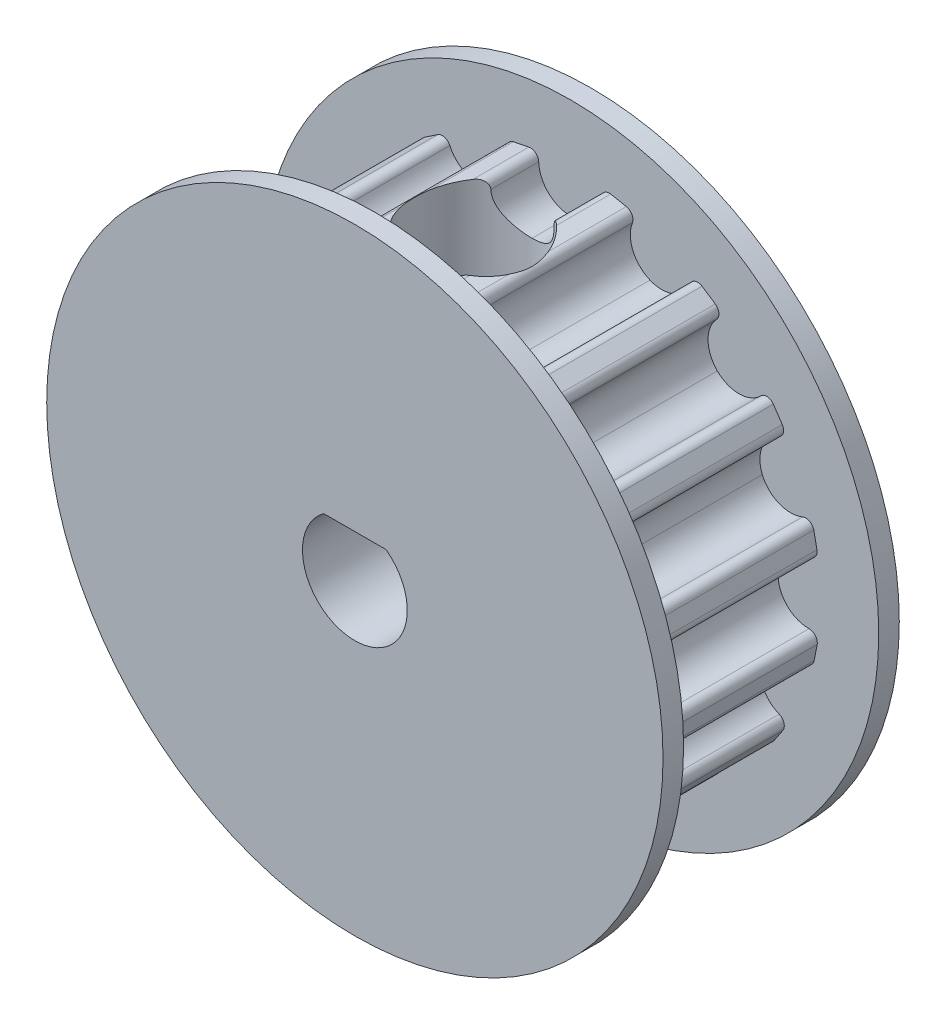
from build123d import *

# Parameters (mm, degrees)
PULLEY_PROFILE_EXTRUSION_DEPTH      = 4.75
PULLEY_PROFILE_EXTRUSION_DEPTH_BACK = 4.75
PULLEY_FLANGE_SKETCH_R              = 15
PULLEY_FLANGE_EXTRUSION_DEPTH       = 1
D_SHAFT_CUT_DEPTH                   = 25.129857024
F_3MM_BOLT_HEAD_HOLE_DEPTH          = 3.1
F_3MM_BOLT_HEAD_HOLE_DEPTH_BACK     = 30.80256293
F_3MM_BOLT_HEAD_SKETCH_R            = 2.875
HEAT_SET_INSERT_SKETCH_R            = 2.3
F_3MM_HEAT_SET_INSERT_HOLE_DEPTH    = 4
F_3MM_BOLT_SHAFT_HOLE_REACH         = 26.128
BOLT_SHAFT_SKETCH_R                 = 1.75


with BuildPart() as part:
    # Pulley Profile → Pulley Profile Extrusion (new, two sides: drawn at the far end of the back side and taken through both)
    with BuildSketch(Plane(origin=(0, 0, 0), x_dir=(0, 1, 0), z_dir=(0, 0, 1)).offset(-PULLEY_PROFILE_EXTRUSION_DEPTH_BACK)):
        with BuildLine():
            Line((1.954191923, 12.004374076), (2.712877822, 11.855975579))
            ThreePointArc((2.712877822, 11.855975579), (2.985721469, 11.657585969), (3.009663583, 11.321090993))
            ThreePointArc((3.009663583, 11.321090993), (3.034360349, 10.153412461), (3.866019365, 9.333396383))
            ThreePointArc((3.866019365, 9.333396383), (5.012665119, 9.336001505), (5.817923106, 10.152312012))
            ThreePointArc((5.817923106, 10.152312012), (6.064332614, 10.382728612), (6.399312995, 10.342758636))
            Line((6.399312995, 10.342758636), (7.043457723, 9.915319779))
            ThreePointArc((7.043457723, 9.915319779), (7.219611967, 9.627618935), (7.112960544, 9.307575864))
            ThreePointArc((7.112960544, 9.307575864), (6.688926151, 8.219330524), (7.143472327, 7.143472327))
            ThreePointArc((7.143472327, 7.143472327), (8.203831807, 6.707076813), (9.260181687, 7.153090492))
            ThreePointArc((9.260181687, 7.153090492), (9.576011003, 7.271670837), (9.870196673, 7.106551952))
            Line((9.870196673, 7.106551952), (10.301735035, 6.465146425))
            ThreePointArc((10.301735035, 6.465146425), (10.354381988, 6.131934193), (10.133373741, 5.877066683))
            ThreePointArc((10.133373741, 5.877066683), (9.325163582, 5.033930024), (9.333396383, 3.866019365))
            ThreePointArc((9.333396383, 3.866019365), (10.146039471, 3.057060476), (11.29266155, 3.064875788))
            ThreePointArc((11.29266155, 3.064875788), (11.629828524, 3.053567094), (11.838432382, 2.788437154))
            Line((11.838432382, 2.788437154), (11.991666572, 2.030713134))
            ThreePointArc((11.991666572, 2.030713134), (11.912791215, 1.702718056), (11.611072645, 1.551827375))
            ThreePointArc((11.611072645, 1.551827375), (10.541729391, 1.08215931), (10.102395447, 0))
            ThreePointArc((10.102395447, 0), (10.543604599, -1.058365606), (11.605936059, -1.489938472))
            ThreePointArc((11.605936059, -1.489938472), (11.913110076, -1.629414558), (12.004374076, -1.954191923))
            Line((12.004374076, -1.954191923), (11.855975579, -2.712877822))
            ThreePointArc((11.855975579, -2.712877822), (11.657585969, -2.985721469), (11.321090993, -3.009663583))
            ThreePointArc((11.321090993, -3.009663583), (10.153412461, -3.034360349), (9.333396383, -3.866019365))
            ThreePointArc((9.333396383, -3.866019365), (9.336001505, -5.012665119), (10.152312012, -5.817923106))
            ThreePointArc((10.152312012, -5.817923106), (10.382728612, -6.064332614), (10.342758636, -6.399312995))
            Line((10.342758636, -6.399312995), (9.915319779, -7.043457723))
            ThreePointArc((9.915319779, -7.043457723), (9.627618935, -7.219611967), (9.307575864, -7.112960544))
            ThreePointArc((9.307575864, -7.112960544), (8.219330524, -6.688926151), (7.143472327, -7.143472327))
            ThreePointArc((7.143472327, -7.143472327), (6.707076813, -8.203831807), (7.153090492, -9.260181687))
            ThreePointArc((7.153090492, -9.260181687), (7.271670837, -9.576011003), (7.106551952, -9.870196673))
            Line((7.106551952, -9.870196673), (6.465146425, -10.301735035))
            ThreePointArc((6.465146425, -10.301735035), (6.131934193, -10.354381988), (5.877066683, -10.133373741))
            ThreePointArc((5.877066683, -10.133373741), (5.033930024, -9.325163582), (3.866019365, -9.333396383))
            ThreePointArc((3.866019365, -9.333396383), (3.057060476, -10.146039471), (3.064875788, -11.29266155))
            ThreePointArc((3.064875788, -11.29266155), (3.053567094, -11.629828524), (2.788437154, -11.838432382))
            Line((2.788437154, -11.838432382), (2.030713134, -11.991666572))
            ThreePointArc((2.030713134, -11.991666572), (1.702718056, -11.912791215), (1.551827375, -11.611072645))
            ThreePointArc((1.551827375, -11.611072645), (1.08215931, -10.541729391), (0, -10.102395447))
            ThreePointArc((0, -10.102395447), (-1.058365606, -10.543604599), (-1.489938472, -11.605936059))
            ThreePointArc((-1.489938472, -11.605936059), (-1.629414558, -11.913110076), (-1.954191923, -12.004374076))
            Line((-1.954191923, -12.004374076), (-2.712877822, -11.855975579))
            ThreePointArc((-2.712877822, -11.855975579), (-2.985721469, -11.657585969), (-3.009663583, -11.321090993))
            ThreePointArc((-3.009663583, -11.321090993), (-3.034360349, -10.153412461), (-3.866019365, -9.333396383))
            ThreePointArc((-3.866019365, -9.333396383), (-5.012665119, -9.336001505), (-5.817923106, -10.152312012))
            ThreePointArc((-5.817923106, -10.152312012), (-6.064332614, -10.382728612), (-6.399312995, -10.342758636))
            Line((-6.399312995, -10.342758636), (-7.043457723, -9.915319779))
            ThreePointArc((-7.043457723, -9.915319779), (-7.219611967, -9.627618935), (-7.112960544, -9.307575864))
            ThreePointArc((-7.112960544, -9.307575864), (-6.688926151, -8.219330524), (-7.143472327, -7.143472327))
            ThreePointArc((-7.143472327, -7.143472327), (-8.203831807, -6.707076813), (-9.260181687, -7.153090492))
            ThreePointArc((-9.260181687, -7.153090492), (-9.576011003, -7.271670837), (-9.870196673, -7.106551952))
            Line((-9.870196673, -7.106551952), (-10.301735035, -6.465146425))
            ThreePointArc((-10.301735035, -6.465146425), (-10.354381988, -6.131934193), (-10.133373741, -5.877066683))
            ThreePointArc((-10.133373741, -5.877066683), (-9.325163582, -5.033930024), (-9.333396383, -3.866019365))
            ThreePointArc((-9.333396383, -3.866019365), (-10.146039471, -3.057060476), (-11.29266155, -3.064875788))
            ThreePointArc((-11.29266155, -3.064875788), (-11.629828524, -3.053567094), (-11.838432382, -2.788437154))
            Line((-11.838432382, -2.788437154), (-11.991666572, -2.030713134))
            ThreePointArc((-11.991666572, -2.030713134), (-11.912791215, -1.702718056), (-11.611072645, -1.551827375))
            ThreePointArc((-11.611072645, -1.551827375), (-10.541729391, -1.08215931), (-10.102395447, 0))
            ThreePointArc((-10.102395447, 0), (-10.543604599, 1.058365606), (-11.605936059, 1.489938472))
            ThreePointArc((-11.605936059, 1.489938472), (-11.913110076, 1.629414558), (-12.004374076, 1.954191923))
            Line((-12.004374076, 1.954191923), (-11.855975579, 2.712877822))
            ThreePointArc((-11.855975579, 2.712877822), (-11.657585969, 2.985721469), (-11.321090993, 3.009663583))
            ThreePointArc((-11.321090993, 3.009663583), (-10.153412461, 3.034360349), (-9.333396383, 3.866019365))
            ThreePointArc((-9.333396383, 3.866019365), (-9.336001505, 5.012665119), (-10.152312012, 5.817923106))
            ThreePointArc((-10.152312012, 5.817923106), (-10.382728612, 6.064332614), (-10.342758636, 6.399312995))
            Line((-10.342758636, 6.399312995), (-9.915319779, 7.043457723))
            ThreePointArc((-9.915319779, 7.043457723), (-9.627618935, 7.219611967), (-9.307575864, 7.112960544))
            ThreePointArc((-9.307575864, 7.112960544), (-8.219330524, 6.688926151), (-7.143472327, 7.143472327))
            ThreePointArc((-7.143472327, 7.143472327), (-6.707076813, 8.203831807), (-7.153090492, 9.260181687))
            ThreePointArc((-7.153090492, 9.260181687), (-7.271670837, 9.576011003), (-7.106551952, 9.870196673))
            Line((-7.106551952, 9.870196673), (-6.465146425, 10.301735035))
            ThreePointArc((-6.465146425, 10.301735035), (-6.131934193, 10.354381988), (-5.877066683, 10.133373741))
            ThreePointArc((-5.877066683, 10.133373741), (-5.033930024, 9.325163582), (-3.866019365, 9.333396383))
            ThreePointArc((-3.866019365, 9.333396383), (-3.057060476, 10.146039471), (-3.064875788, 11.29266155))
            ThreePointArc((-3.064875788, 11.29266155), (-3.053567094, 11.629828524), (-2.788437154, 11.838432382))
            Line((-2.788437154, 11.838432382), (-2.030713134, 11.991666572))
            ThreePointArc((-2.030713134, 11.991666572), (-1.702718056, 11.912791215), (-1.551827375, 11.611072645))
            ThreePointArc((-1.551827375, 11.611072645), (-1.08215931, 10.541729391), (0, 10.102395447))
            ThreePointArc((0, 10.102395447), (1.058365606, 10.543604599), (1.489938472, 11.605936059))
            ThreePointArc((1.489938472, 11.605936059), (1.629414558, 11.913110076), (1.954191923, 12.004374076))
        make_face()
    extrude(amount=PULLEY_PROFILE_EXTRUSION_DEPTH + PULLEY_PROFILE_EXTRUSION_DEPTH_BACK)

    # Pulley Flange Sketch → Pulley Flange Extrusion (add)
    with BuildSketch(Plane.XY.offset(4.75)):
        Circle(PULLEY_FLANGE_SKETCH_R)
    pulley_flange_extrusion = extrude(amount=PULLEY_FLANGE_EXTRUSION_DEPTH)

    # Flange Mirror: Pulley Flange Extrusion across plane
    add(pulley_flange_extrusion.mirror(Plane.XY))

    # D-Shaft Sketch → D-Shaft Cut (cut, through all)
    with BuildSketch(Plane(origin=(0, 0, -5.75), x_dir=(1, 0, 0), z_dir=(0, 0, -1))):
        with BuildLine():
            Line((-1.516575089, -2.05), (1.516575089, -2.05))
            ThreePointArc((1.516575089, -2.05), (0, 2.55), (-1.516575089, -2.05))
        make_face()
    extrude(amount=-D_SHAFT_CUT_DEPTH, mode=Mode.SUBTRACT)

    # 3mm Bolt Head Sketch → 3mm Bolt Head Hole (cut, two sides: drawn at the far end of the back side and taken through both)
    with BuildSketch(Plane(origin=(0, 10.102395447, 0), x_dir=(-1, 0, 0), z_dir=(0, -1, 0)).offset(-F_3MM_BOLT_HEAD_HOLE_DEPTH_BACK)):
        Circle(F_3MM_BOLT_HEAD_SKETCH_R)
    extrude(amount=F_3MM_BOLT_HEAD_HOLE_DEPTH + F_3MM_BOLT_HEAD_HOLE_DEPTH_BACK, mode=Mode.SUBTRACT)

    # Heat Set Insert Sketch → 3mm Heat Set Insert Hole (cut)
    with BuildSketch(Plane(origin=(0, 7.002395447, 0), x_dir=(-1, 0, 0), z_dir=(0, 1, 0))):
        Circle(HEAT_SET_INSERT_SKETCH_R)
    extrude(amount=-F_3MM_HEAT_SET_INSERT_HOLE_DEPTH, mode=Mode.SUBTRACT)

    # Bolt Shaft Sketch → 3mm Bolt Shaft Hole (cut, up to next)
    with BuildSketch(Plane(origin=(0, 3.002395447, 0), x_dir=(-1, 0, 0), z_dir=(0, 1, 0)), mode=Mode.PRIVATE) as f_3mm_bolt_shaft_hole_sk1:
        Circle(BOLT_SHAFT_SKETCH_R)
    f_3mm_bolt_shaft_hole_tool1 = extrude(f_3mm_bolt_shaft_hole_sk1.sketch, amount=-F_3MM_BOLT_SHAFT_HOLE_REACH, mode=Mode.PRIVATE) & part.part
    add(f_3mm_bolt_shaft_hole_tool1.solids().sort_by_distance((0, 3.002395, 0))[0], mode=Mode.SUBTRACT)


solid = part.part
